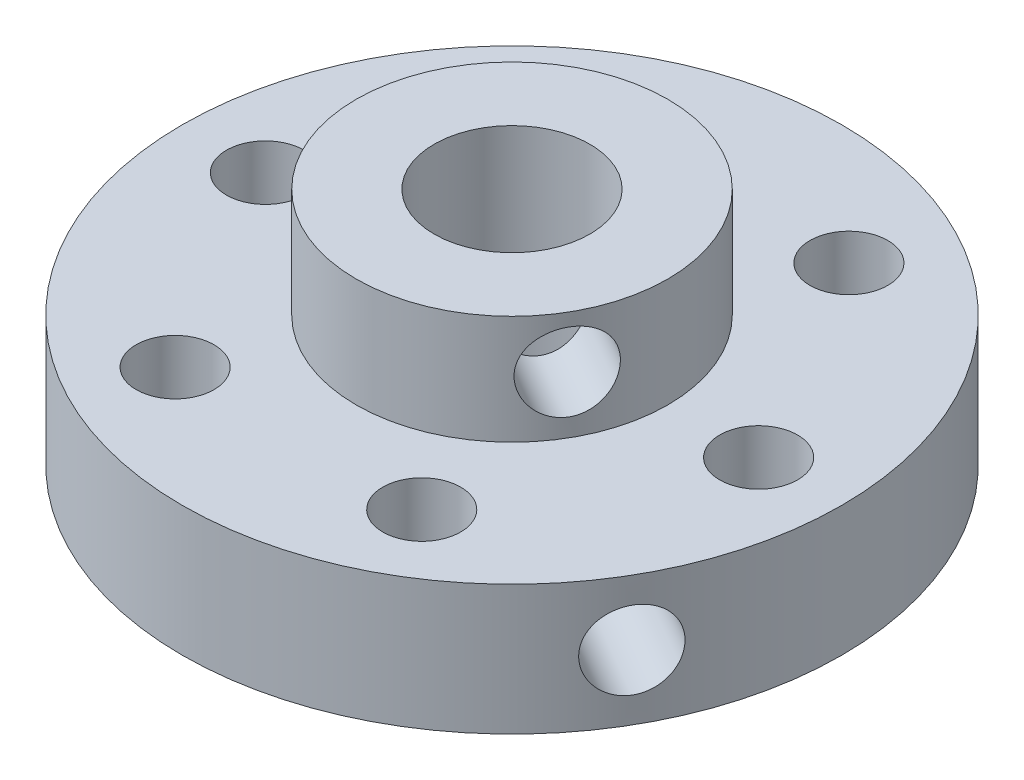
from build123d import *

# Parameters (mm, degrees)
SKETCH1_R           = 12.7
BOSS_EXTRUDE1_DEPTH = 5
SKETCH2_R           = 6
BOSS_EXTRUDE2_DEPTH = 4.2
SKETCH3_R           = 3
SKETCH3_R_2         = 1.5
CUT_EXTRUDE1_DEPTH  = 14.2
SKETCH5_R           = 1.5
CUT_EXTRUDE2_DEPTH  = 7.1


with BuildPart() as part:
    # Sketch1 → Boss-Extrude1 (new body)
    with BuildSketch(Plane(origin=(0, 0, 0), x_dir=(1, 0, 0), z_dir=(0, 1, 0))):
        with Locations(Location((0, 0, 0), (0, 0, 270))):
            Circle(SKETCH1_R)
    extrude(amount=BOSS_EXTRUDE1_DEPTH)

    # Sketch2 → Boss-Extrude2 (add)
    with BuildSketch(Plane(origin=(0, 5, 0), x_dir=(1, 0, 0), z_dir=(0, 1, 0))):
        with Locations(Location((0, 0, 0), (0, 0, 270))):
            Circle(SKETCH2_R)
    extrude(amount=BOSS_EXTRUDE2_DEPTH)

    # Sketch3 → Cut-Extrude1 (cut)
    with BuildSketch(Plane(origin=(0, 9.2, 0), x_dir=(1, 0, 0), z_dir=(0, 1, 0))):
        with Locations(Location((0, 0, 0), (0, 0, 270))):
            Circle(SKETCH3_R)
        with Locations(Location((-9.5, 0, 0), (0, 0, 270))):
            Circle(SKETCH3_R_2)
        with Locations(Location((-4.75, 8.227241336, 0), (0, 0, 270))):
            Circle(SKETCH3_R_2)
        with Locations(Location((4.75, 8.227241336, 0), (0, 0, 270))):
            Circle(SKETCH3_R_2)
        with Locations(Location((9.5, 0, 0), (0, 0, 270))):
            Circle(SKETCH3_R_2)
        with Locations(Location((4.75, -8.227241336, 0), (0, 0, 270))):
            Circle(SKETCH3_R_2)
        with Locations(Location((-4.75, -8.227241336, 0), (0, 0, 270))):
            Circle(SKETCH3_R_2)
    extrude(amount=-CUT_EXTRUDE1_DEPTH, mode=Mode.SUBTRACT)

    # Sketch5 → Cut-Extrude2 (cut, symmetric)
    with BuildSketch(Plane(origin=(7.125, 0, 4.113620668), x_dir=(0.5000000000000071, 0, -0.8660254037844346), z_dir=(0.8660254037844346, 0, 0.5000000000000071))):
        with Locations((0, 2.5)):
            Circle(SKETCH5_R)
        with Locations((0, 7.2)):
            Circle(SKETCH5_R)
    extrude(amount=CUT_EXTRUDE2_DEPTH, both=True, mode=Mode.SUBTRACT)


solid = part.part
